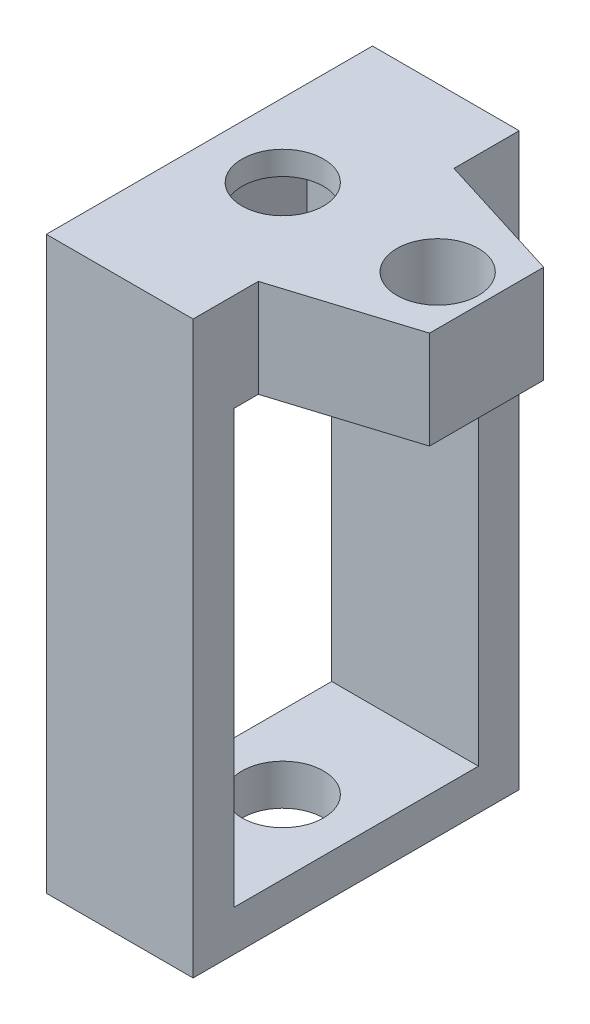
from build123d import *

# Parameters (mm, degrees)
BOSS_EXTRUDE1_DEPTH             = 3
CUT_EXTRUDE1_DEPTH              = 17.286497475
CUT_EXTRUDE1_DEPTH_BACK         = 17.286497475
SUPPORT_HOLE_R                  = 2.5
EXTRUDE_THIN1_REACH             = 57.365
EXTRUDE_THIN1_DIRECTION_2_REACH = 57.365
CUT_EXTRUDE2_DEPTH              = 36.780581326
CUT_EXTRUDE2_DEPTH_BACK         = 36.780581326
SKETCH6_R                       = 2.5
CUT_EXTRUDE3_DEPTH              = 1.55


with BuildPart() as part:
    # Sketch3 → Boss-Extrude1 (new, symmetric)
    with BuildSketch(Plane(origin=(0, -50, 0), x_dir=(1, 0, 0), z_dir=(0, 1, 0))):
        Polygon((-4.5, 10), (-4.5, -10), (4.5, -10), (4.5, -6), (12.5, -3.5), (12.5, 3.5), (4.5, 6), (4.5, 10), align=None)
    extrude(amount=BOSS_EXTRUDE1_DEPTH, both=True)

    # Support_hole → Cut-Extrude1 (cut, two sides: drawn at the far end of the back side and taken through both)
    with BuildSketch(Plane(origin=(0, -50, 0), x_dir=(1, 0, 0), z_dir=(0, 1, 0)).offset(-CUT_EXTRUDE1_DEPTH_BACK)):
        with Locations((9.5, 0)):
            Circle(SUPPORT_HOLE_R)
    extrude(amount=CUT_EXTRUDE1_DEPTH + CUT_EXTRUDE1_DEPTH_BACK, mode=Mode.SUBTRACT)

    # Extrude-Thin1: up to this face of the body (flat: up to its plane)
    extrude_thin1_end = Plane(part.part.faces().sort_by_distance((4.5, -50, 8))[0])
    # Sketch8 → Extrude-Thin1 (add, up to the picked face)
    with BuildSketch(Plane(origin=(0, 0, 0), x_dir=(0, 0, -1), z_dir=(1, 0, 0)), mode=Mode.PRIVATE) as extrude_thin1_sk1:
        Polygon((-10, -53), (-10, -82), (10, -82), (10, -53), (7.5, -53), (7.5, -79.5), (-7.5, -79.5), (-7.5, -53), align=None)
    extrude_thin1_tool1 = split(extrude(extrude_thin1_sk1.sketch, amount=EXTRUDE_THIN1_REACH, mode=Mode.PRIVATE), bisect_by=extrude_thin1_end, keep=Keep.BOTH, mode=Mode.PRIVATE)
    add(extrude_thin1_tool1.solids().sort_by(Axis((0, -67.5, 9.647722), (1, 0, 0)))[0])

    # Extrude-Thin1 direction 2: up to this face of the body (flat: up to its plane)
    extrude_thin1_direction_2_end = Plane(part.part.faces().sort_by_distance((-4.5, -50, 0))[0])
    # Sketch8 → Extrude-Thin1 direction 2 (add, up to the picked face)
    with BuildSketch(Plane(origin=(0, 0, 0), x_dir=(0, 0, -1), z_dir=(1, 0, 0)), mode=Mode.PRIVATE) as extrude_thin1_direction_2_sk1:
        Polygon((-10, -53), (-10, -82), (10, -82), (10, -53), (7.5, -53), (7.5, -79.5), (-7.5, -79.5), (-7.5, -53), align=None)
    extrude_thin1_direction_2_tool1 = split(extrude(extrude_thin1_direction_2_sk1.sketch, amount=-EXTRUDE_THIN1_DIRECTION_2_REACH, mode=Mode.PRIVATE), bisect_by=extrude_thin1_direction_2_end, keep=Keep.BOTH, mode=Mode.PRIVATE)
    add(extrude_thin1_direction_2_tool1.solids().sort_by(Axis((0, -67.5, 9.647722), (-1, 0, 0)))[0])

    # Sketch6 → Cut-Extrude2 (cut, two sides: drawn at the far end of the back side and taken through both)
    with BuildSketch(Plane(origin=(0, -50, 0), x_dir=(1, 0, 0), z_dir=(0, 1, 0)).offset(-CUT_EXTRUDE2_DEPTH_BACK)):
        Circle(SKETCH6_R)
    extrude(amount=CUT_EXTRUDE2_DEPTH + CUT_EXTRUDE2_DEPTH_BACK, mode=Mode.SUBTRACT)

    # Sketch7 → Cut-Extrude3 (cut, symmetric)
    with BuildSketch(Plane(origin=(0, -50, 0), x_dir=(1, 0, 0), z_dir=(0, 1, 0))):
        Polygon((2.020725942, -3.5), (4.041451884, 0), (2.020725942, 3.5), (-2.020725942, 3.5), (-4.041451884, 0), (-2.020725942, -3.5), align=None)
    extrude(amount=CUT_EXTRUDE3_DEPTH, both=True, mode=Mode.SUBTRACT)


solid = part.part
